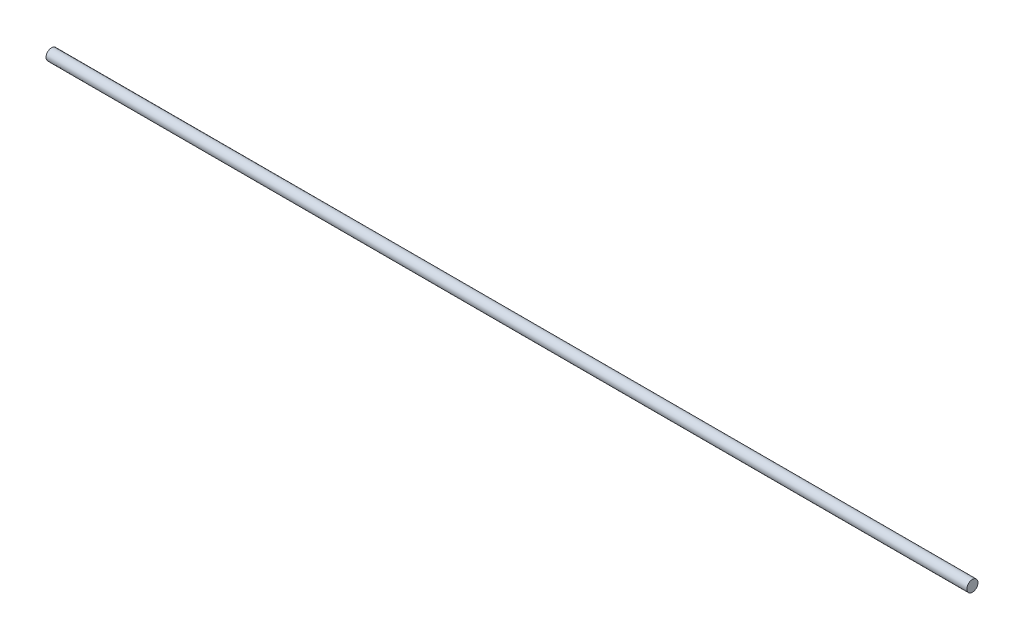
from build123d import *

# Parameters (mm, degrees)
BOSS_EXTRUDE1_DEPTH      = 82.5
BOSS_EXTRUDE1_DEPTH_BACK = 82.5
SKETCH1_R                = 1


with BuildPart() as part:
    # Sketch1 → Boss-Extrude1 (new, two sides: drawn at the far end of the back side and taken through both)
    with BuildSketch(Plane(origin=(0, 0, 0), x_dir=(0, 0, -1), z_dir=(1, 0, 0)).offset(-BOSS_EXTRUDE1_DEPTH_BACK)):
        Circle(SKETCH1_R)
    extrude(amount=BOSS_EXTRUDE1_DEPTH + BOSS_EXTRUDE1_DEPTH_BACK)


solid = part.part
